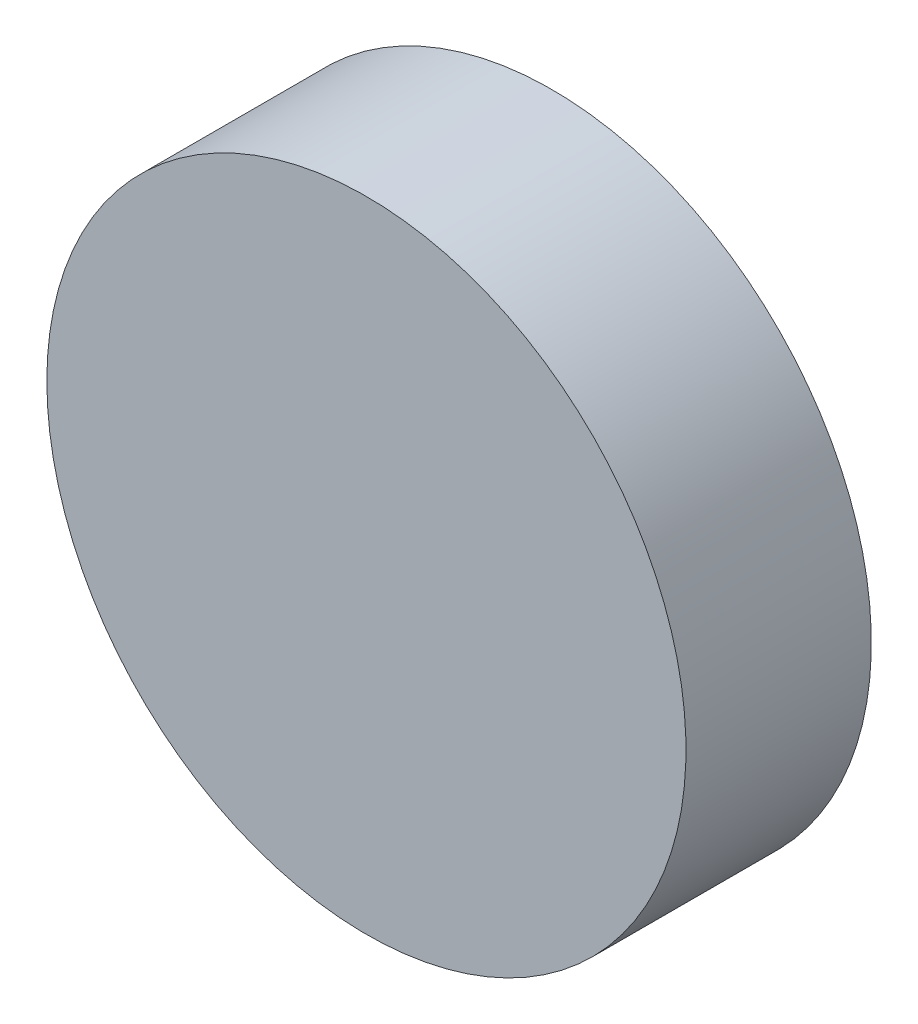
from build123d import *

# Parameters (mm, degrees)
SKETCH_1_R      = 50
EXTRUDE_1_DEPTH = 29


with BuildPart() as part:
    # 草图1 → 凸台-拉伸1 (new body)
    with BuildSketch(Plane.XY):
        with Locations(Location((0, 0, 0), (0, 0, 180))):
            Circle(SKETCH_1_R)
    extrude(amount=EXTRUDE_1_DEPTH)


solid = part.part
